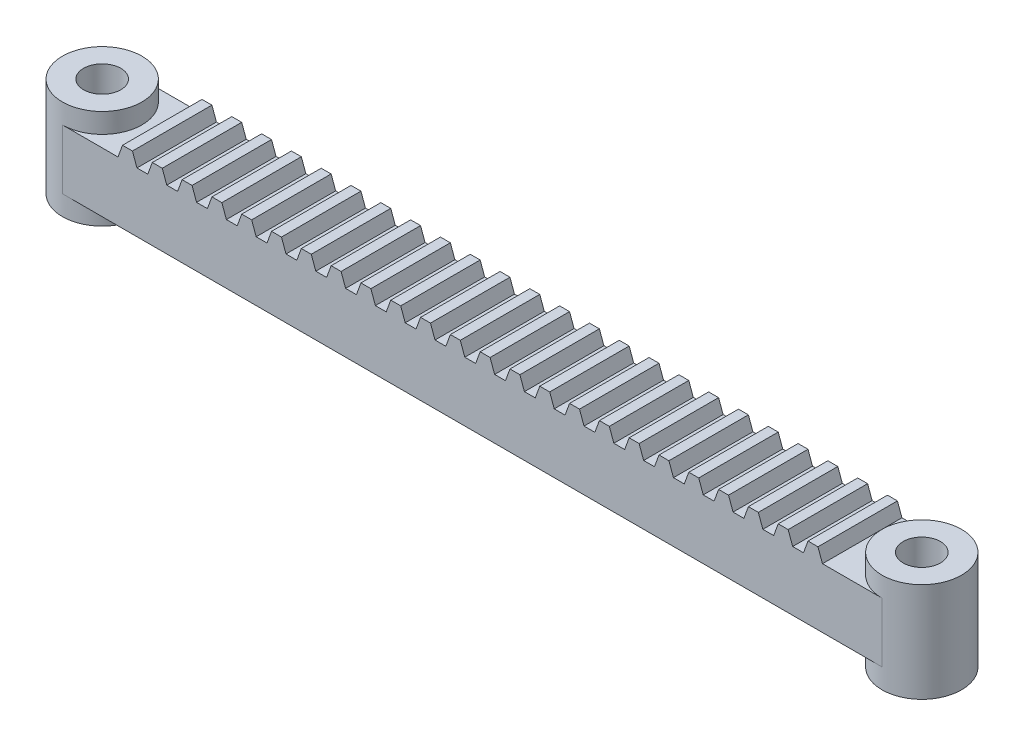
from build123d import *
from build123d.topology import SkipClean

# Parameters (mm, degrees)
SKETCH1_R             = 8
SKETCH1_R_2           = 3.75
BOSS_EXTRUDE1_DEPTH   = 20
BOSS_EXTRUDE1_2_DEPTH = 20
BOSS_EXTRUDE2_DEPTH   = 8
SKETCH1_4_R           = 8
SKETCH1_4_R_2         = 3.75
BOSS_EXTRUDE3_DEPTH   = 16
SKETCH3_R             = 3.75
CUT_EXTRUDE2_DEPTH    = 16
SKETCH4_R             = 3.75
CUT_EXTRUDE3_DEPTH    = 16


with BuildPart() as part:
    # Sketch1 → Boss-Extrude1 (new body)
    with BuildSketch(Plane(origin=(0, 0, 0), x_dir=(1, 0, 0), z_dir=(0, 1, 0))):
        Circle(SKETCH1_R)
        Circle(SKETCH1_R_2, mode=Mode.SUBTRACT)
    extrude(amount=BOSS_EXTRUDE1_DEPTH)



with BuildPart() as body_2:
    # Sketch1 → Boss-Extrude1 2 (new body)
    with BuildSketch(Plane(origin=(0, 0, 0), x_dir=(1, 0, 0), z_dir=(0, 1, 0))):
        with Locations((-165, 0)):
            Circle(SKETCH1_R)
        with Locations((-165, 0)):
            Circle(SKETCH1_R_2, mode=Mode.SUBTRACT)
    extrude(amount=BOSS_EXTRUDE1_2_DEPTH)


with BuildPart() as part_1:
    add(part.part)

    add(body_2.part)  # Boss-Extrude2 merges body 2
    # Sketch2 → Boss-Extrude2 (add, symmetric)
    with BuildSketch(Plane.XY):
        Polygon((0, 4), (-165, 4), (-165, 11.640611033), (-165, 16), (-157, 16), (-153.819851171, 16), (-152.909925586, 18.5), (-151.909925586, 18.5), (-150.909925586, 18.5), (-150, 16), (-147.819851171, 16), (-146.909925586, 18.5), (-145.909925586, 18.5), (-144.909925586, 18.5), (-144, 16), (-141.819851171, 16), (-140.909925586, 18.5), (-139.909925586, 18.5), (-138.909925586, 18.5), (-138, 16), (-135.819851171, 16), (-134.909925586, 18.5), (-133.909925586, 18.5), (-132.909925586, 18.5), (-132, 16), (-129.819851171, 16), (-128.909925586, 18.5), (-127.909925586, 18.5), (-126.909925586, 18.5), (-126, 16), (-123.819851171, 16), (-122.909925586, 18.5), (-121.909925586, 18.5), (-120.909925586, 18.5), (-120, 16), (-117.819851171, 16), (-116.909925586, 18.5), (-115.909925586, 18.5), (-114.909925586, 18.5), (-114, 16), (-111.819851171, 16), (-110.909925586, 18.5), (-109.909925586, 18.5), (-108.909925586, 18.5), (-108, 16), (-105.819851171, 16), (-104.909925586, 18.5), (-103.909925586, 18.5), (-102.909925586, 18.5), (-102, 16), (-99.819851171, 16), (-98.909925586, 18.5), (-97.909925586, 18.5), (-96.909925586, 18.5), (-96, 16), (-93.819851171, 16), (-92.909925586, 18.5), (-91.909925586, 18.5), (-90.909925586, 18.5), (-90, 16), (-87.819851171, 16), (-86.909925586, 18.5), (-85.909925586, 18.5), (-84.909925586, 18.5), (-84, 16), (-81.819851171, 16), (-80.909925586, 18.5), (-79.909925586, 18.5), (-78.909925586, 18.5), (-78, 16), (-75.819851171, 16), (-74.909925586, 18.5), (-73.909925586, 18.5), (-72.909925586, 18.5), (-72, 16), (-69.819851171, 16), (-68.909925586, 18.5), (-67.909925586, 18.5), (-66.909925586, 18.5), (-66, 16), (-63.819851171, 16), (-62.909925586, 18.5), (-61.909925586, 18.5), (-60.909925586, 18.5), (-60, 16), (-57.819851171, 16), (-56.909925586, 18.5), (-55.909925586, 18.5), (-54.909925586, 18.5), (-54, 16), (-51.819851171, 16), (-50.909925586, 18.5), (-49.909925586, 18.5), (-48.909925586, 18.5), (-48, 16), (-45.819851171, 16), (-44.909925586, 18.5), (-43.909925586, 18.5), (-42.909925586, 18.5), (-42, 16), (-39.819851171, 16), (-38.909925586, 18.5), (-37.909925586, 18.5), (-36.909925586, 18.5), (-36, 16), (-33.819851171, 16), (-32.909925586, 18.5), (-31.909925586, 18.5), (-30.909925586, 18.5), (-30, 16), (-27.819851171, 16), (-26.909925586, 18.5), (-25.909925586, 18.5), (-24.909925586, 18.5), (-24, 16), (-21.819851171, 16), (-20.909925586, 18.5), (-19.909925586, 18.5), (-18.909925586, 18.5), (-18, 16), (-15.819851171, 16), (-14.909925586, 18.5), (-13.909925586, 18.5), (-12.909925586, 18.5), (-12, 16), (0, 16), align=None)
    extrude(amount=BOSS_EXTRUDE2_DEPTH, both=True)

    # Sketch1<4> → Boss-Extrude3 (add)
    # profile 1 of 2: a face of its own
    with BuildSketch(Plane(origin=(0, 0, 0), x_dir=(1, 0, 0), z_dir=(0, 1, 0))):
        Circle(SKETCH1_4_R)
        Circle(SKETCH1_4_R_2, mode=Mode.SUBTRACT)
    # profile 2 of 2: a face of its own
    with BuildSketch(Plane(origin=(0, 0, 0), x_dir=(1, 0, 0), z_dir=(0, 1, 0))):
        with Locations((-165, 0)):
            Circle(SKETCH1_4_R)
        with Locations((-165, 0)):
            Circle(SKETCH1_4_R_2, mode=Mode.SUBTRACT)
    extrude(amount=BOSS_EXTRUDE3_DEPTH)

    # Sketch3 → Cut-Extrude2 (cut)
    with SkipClean():  # the faces are left unmerged after this step: merging them gives an invalid solid
        with BuildSketch(Plane(origin=(0, 0, 0), x_dir=(-1, 0, 0), z_dir=(0, -1, 0))):
            with Locations((165, 0)):
                Circle(SKETCH3_R)
        extrude(amount=-CUT_EXTRUDE2_DEPTH, mode=Mode.SUBTRACT)

    # Sketch4 → Cut-Extrude3 (cut)
    with SkipClean():  # the faces are left unmerged after this step: merging them gives an invalid solid
        with BuildSketch(Plane(origin=(0, 0, 0), x_dir=(-1, 0, 0), z_dir=(0, -1, 0))):
            Circle(SKETCH4_R)
        extrude(amount=-CUT_EXTRUDE3_DEPTH, mode=Mode.SUBTRACT)


solid = part_1.part
